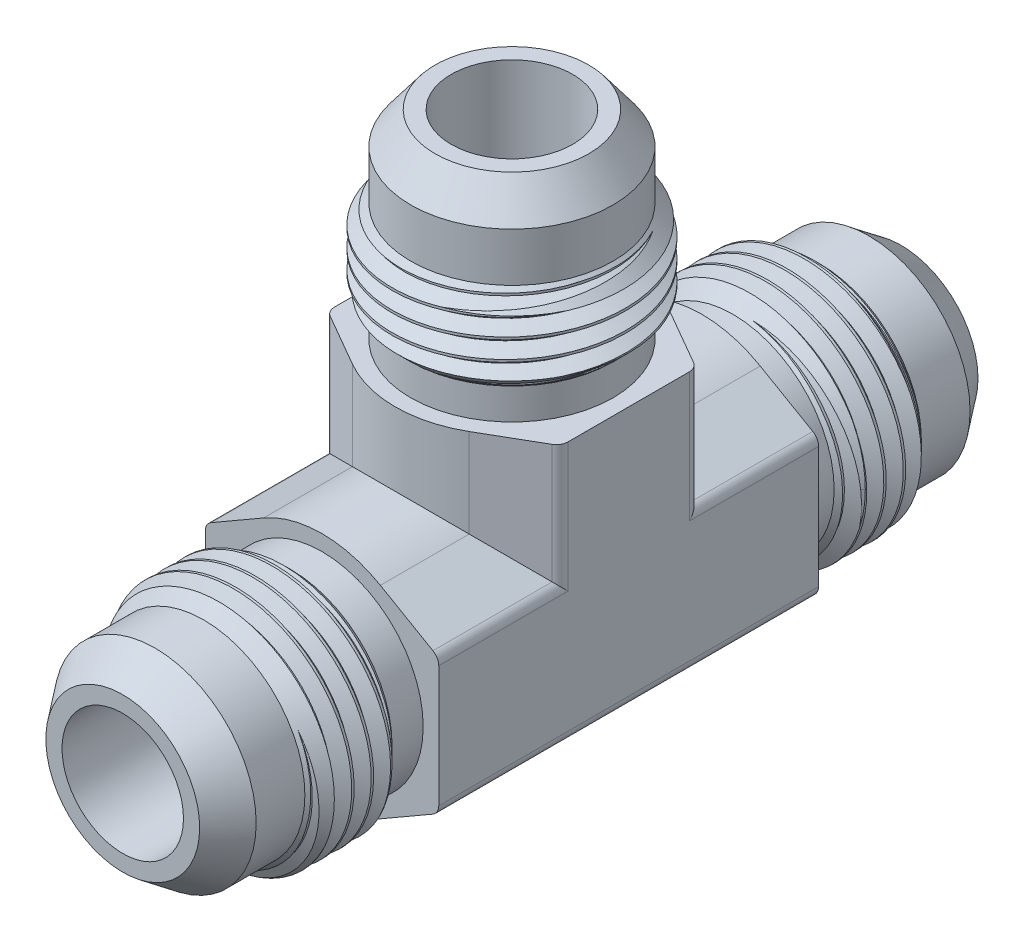
from build123d import *

# Parameters (mm, degrees)
BOSS_EXTRUDE1_START     = -15.494
BOSS_EXTRUDE1_DEPTH     = 15.494
CIRPATTERN1_COUNT       = 3
CIRPATTERN1_ANGLE       = 180
CUT_EXTRUDE1_DEPTH      = 40.047337057
CUT_EXTRUDE1_DEPTH_BACK = 40.047337057
SKETCH5_R               = 4.953
CUT_EXTRUDE2_REACH      = 54.938
CUT_EXTRUDE2_END_RADIUS = 4.953
SKETCH6_R               = 4.953
CUT_SWEEP1_PITCH        = 1.5875
CUT_SWEEP1_HEIGHT       = 8.6995
CUT_SWEEP1_RADIUS       = 9.525
CUT_SWEEP1_START_ANGLE  = 90
CIRPATTERN2_COUNT       = 3
CIRPATTERN2_ANGLE       = 180


with BuildPart() as part:
    # Sketch3 → Revolve1 (revolve)
    with BuildSketch(Plane(origin=(0, 0, 0), x_dir=(0, 0, -1), z_dir=(1, 0, 0)), mode=Mode.PRIVATE) as revolve1_sk:
        Polygon((-31.75, -11.1125), (0, -11.1125), (0, -6.1595), (-15.494, -6.1595), (-15.494, -2.8575), (-18.034, -2.8575), (-19.304, -1.5875), (-23.876, -1.5875), (-25.146, -2.8575), (-29.120858799, -2.8575), (-31.75, -4.8387), align=None)
    revolve(revolve1_sk.sketch.rotate(Axis((0, -11.1125, 31.75), (0, 0, -1)), 90), axis=Axis((0, -11.1125, 31.75), (0, 0, -1)))

    # Sketch4 → Boss-Extrude1 (add)
    with BuildSketch(Plane(origin=(0, 0, 0), x_dir=(-1, 0, 0), z_dir=(0, 0, -1)).offset(BOSS_EXTRUDE1_START)):
        with BuildLine():
            Line((-4.7625, -2.863608029), (-9.04875, -5.33827562))
            ThreePointArc((-9.04875, -5.33827562), (-9.397389197, -5.686914817), (-9.525, -6.163164817))
            Line((-9.525, -6.163164817), (-9.525, -16.061835183))
            ThreePointArc((-9.525, -16.061835183), (-9.397389197, -16.538085183), (-9.04875, -16.88672438))
            Line((-9.04875, -16.88672438), (-4.7625, -19.361391971))
            ThreePointArc((-4.7625, -19.361391971), (0, -20.6375), (4.7625, -19.361391971))
            Line((4.7625, -19.361391971), (9.04875, -16.88672438))
            ThreePointArc((9.04875, -16.88672438), (9.397389197, -16.538085183), (9.525, -16.061835183))
            Line((9.525, -16.061835183), (9.525, -6.163164817))
            ThreePointArc((9.525, -6.163164817), (9.397389197, -5.686914817), (9.04875, -5.33827562))
            Line((9.04875, -5.33827562), (4.7625, -2.863608029))
            ThreePointArc((4.7625, -2.863608029), (0, -1.5875), (-4.7625, -2.863608029))
        make_face()
    extrude(amount=BOSS_EXTRUDE1_DEPTH)


with BuildPart() as cirpattern1_1:
    # CirPattern1: pattern copy
    add(part.part.rotate(Axis((0, -11.1125, 0), (-1, 0, 0)), 1 * CIRPATTERN1_ANGLE / (CIRPATTERN1_COUNT - 1)))


with BuildPart() as cirpattern1_2:
    # CirPattern1: pattern copy
    add(part.part.rotate(Axis((0, -11.1125, 0), (-1, 0, 0)), 2 * CIRPATTERN1_ANGLE / (CIRPATTERN1_COUNT - 1)))


with BuildPart() as cirpattern1_1_1:
    add(cirpattern1_1.part)

    # Combine1: union CirPattern1_2, part
    add(cirpattern1_2.part)
    add(part.part)

    # Sketch5 → Cut-Extrude1 (cut, two sides: drawn at the far end of the back side and taken through both)
    with BuildSketch(Plane.XY.offset(-CUT_EXTRUDE1_DEPTH_BACK)):
        with Locations((0, -11.1125)):
            Circle(SKETCH5_R)
    extrude(amount=CUT_EXTRUDE1_DEPTH + CUT_EXTRUDE1_DEPTH_BACK, mode=Mode.SUBTRACT)

    # Cut-Extrude2: up to this cylinder (the profile starts outside it)
    cut_extrude2_end = Plane(origin=(0, -11.1125, 0), z_dir=(0, 0, 1)) * Cylinder(CUT_EXTRUDE2_END_RADIUS, 120.782, mode=Mode.PRIVATE)
    # Sketch6 → Cut-Extrude2 (cut, up to the surface)
    with BuildSketch(Plane(origin=(0, 20.6375, 0), x_dir=(1, 0, 0), z_dir=(0, 1, 0)), mode=Mode.PRIVATE) as cut_extrude2_sk1:
        with Locations(Location((0, 0, 0), (0, 0, 270))):
            Circle(SKETCH6_R)
    cut_extrude2_tool1 = extrude(cut_extrude2_sk1.sketch, amount=-CUT_EXTRUDE2_REACH, mode=Mode.PRIVATE) - cut_extrude2_end
    add(cut_extrude2_tool1.solids().sort_by_distance((0, 20.6375, 0))[0], mode=Mode.SUBTRACT)

    # Cut-Sweep1: sweep along a helix
    with BuildLine() as cut_sweep1_path:
        add(Helix(CUT_SWEEP1_PITCH, CUT_SWEEP1_HEIGHT, CUT_SWEEP1_RADIUS, center=(0, -11.1125, 18.034), direction=(0, 0, 1), mode=Mode.PRIVATE).rotate(Axis((0, -11.1125, 18.034), (0, 0, 1)), CUT_SWEEP1_START_ANGLE))
    # Sketch8 → Cut-Sweep1 (sweep, cut)
    with BuildSketch(Plane(origin=(0, 0, 0), x_dir=(0, 0, -1), z_dir=(1, 0, 0))):
        Polygon((-16.54571875, -1.415648084), (-18.083609375, -1.501574042), (-17.4386875, -2.618611496), (-17.24025, -2.618611496), align=None)
    cut_sweep1 = sweep(path=cut_sweep1_path.line, is_frenet=True, mode=Mode.SUBTRACT)

    # CirPattern2: Cut-Sweep1 ×3 about axis
    cirpattern2_axis = Axis((9.525, -11.1125, 0), (-1, 0, 0))
    for i in range(1, CIRPATTERN2_COUNT):
        add(cut_sweep1.rotate(cirpattern2_axis, i * CIRPATTERN2_ANGLE / (CIRPATTERN2_COUNT - 1)), mode=Mode.SUBTRACT)


solid = cirpattern1_1_1.part
